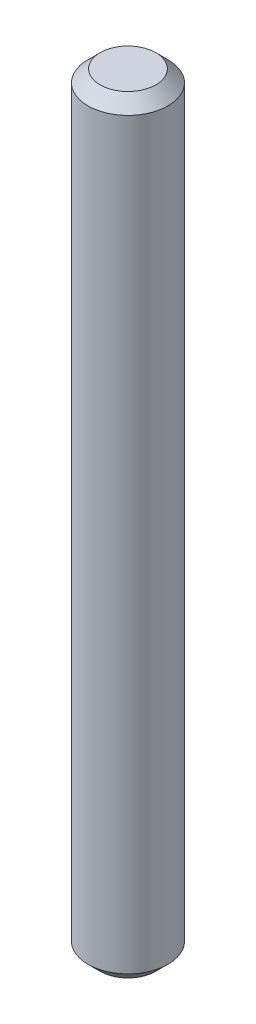
from build123d import *

# Parameters (mm, degrees)
SKETCH1_R           = 9.9
BOSS_EXTRUDE1_DEPTH = 190
CHAMFER1_SIZE       = 3


with BuildPart() as part:
    # Sketch1 → Boss-Extrude1 (new body)
    with BuildSketch(Plane(origin=(0, 0, 0), x_dir=(1, 0, 0), z_dir=(0, 1, 0))):
        with Locations(Location((0, 0, 0), (0, 0, 270))):
            Circle(SKETCH1_R)
    extrude(amount=BOSS_EXTRUDE1_DEPTH)

    # Chamfer1
    chamfer1_edges = [part.edges().sort_by_distance(p)[0] for p in [
        (0, 0, -9.9),
        (0, 190, -9.9),
    ]]
    chamfer(chamfer1_edges, length=CHAMFER1_SIZE)


solid = part.part
